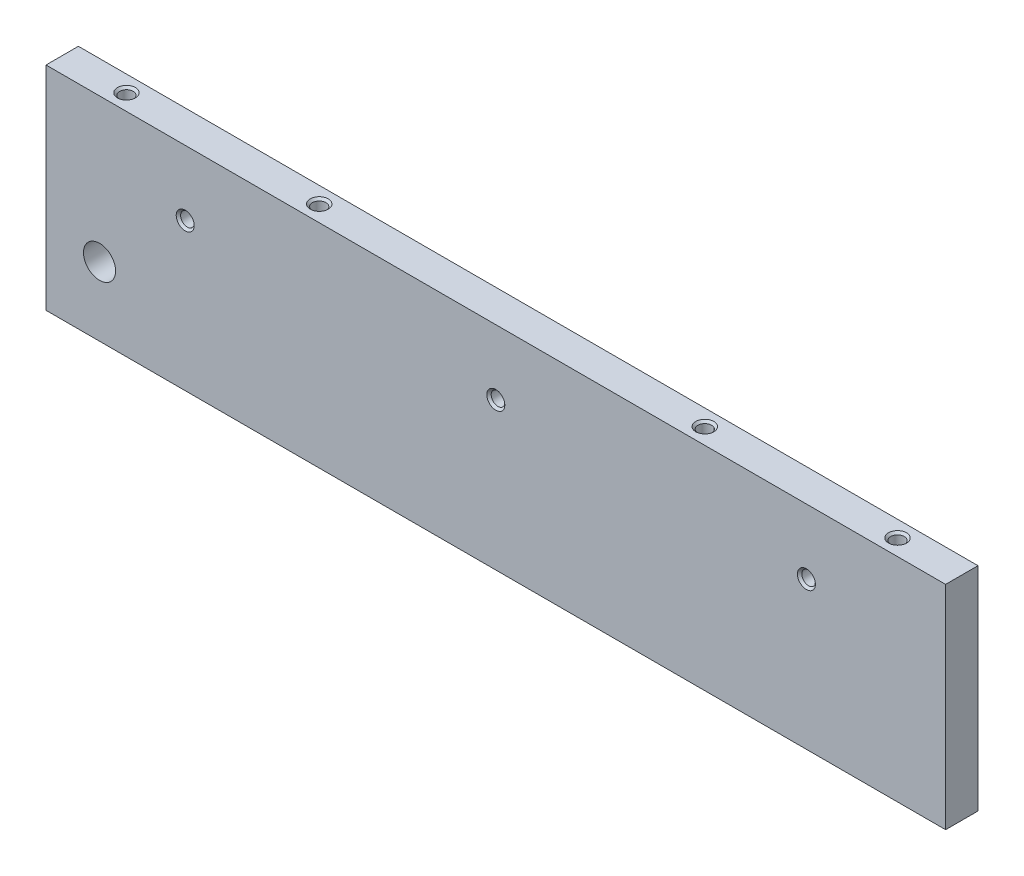
from build123d import *

# Parameters (mm, degrees)
SKETCH1_W                        = 266.7
SKETCH1_H                        = 62.992
BOSS_EXTRUDE1_DEPTH              = 9.6012
F_10_32_TAPPED_HOLE1_AT_2_COUNT  = 2
F_10_32_TAPPED_HOLE1_AT_2_PITCH  = 92.075
F_10_32_TAPPED_HOLE1_AT_3_COUNT  = 2
F_10_32_TAPPED_HOLE1_AT_3_PITCH  = 184.15
F_3_8_0_3750_DOWEL_HOLE1_D       = 9.525
F_10_32_TAPPED_HOLE2_D           = 4.0386
F_10_32_TAPPED_HOLE2_DEPTH       = 19.05
F_10_32_TAPPED_HOLE2_CSINK_D     = 5.334
F_10_32_TAPPED_HOLE2_CSINK_ANGLE = 90
F_10_32_TAPPED_HOLE2_TIP         = 1.213317848


with BuildPart() as part:
    # Sketch1 → Boss-Extrude1 (new body)
    with BuildSketch(Plane.XY):
        with Locations((0, -31.496)):
            Rectangle(SKETCH1_W, SKETCH1_H)
    extrude(amount=BOSS_EXTRUDE1_DEPTH)

    # Sketch2 → #10-32 Tapped Hole1 (revolve, cut)
    with BuildSketch(Plane(origin=(92.075, -19.304, 9.6012), x_dir=(0, -1, 0), z_dir=(1, 0, 0))):
        Polygon((0, 0), (0, 9.6012), (2.667, 9.6012), (2.0193, 8.9535), (2.0193, 0.6477), (2.667, 0), align=None)
    f_10_32_tapped_hole1 = revolve(axis=Axis((92.075, -19.304, 15.9512), (0, 0, -1)), mode=Mode.SUBTRACT)

    # #10-32 Tapped Hole1 at 2: #10-32 Tapped Hole1 ×2
    with Locations(*[(-i * F_10_32_TAPPED_HOLE1_AT_2_PITCH, 0, 0) for i in range(1, F_10_32_TAPPED_HOLE1_AT_2_COUNT)]):
        add(f_10_32_tapped_hole1, mode=Mode.SUBTRACT)

    # #10-32 Tapped Hole1 at 3: #10-32 Tapped Hole1 ×2
    with Locations(*[(-i * F_10_32_TAPPED_HOLE1_AT_3_PITCH, 0, 0) for i in range(1, F_10_32_TAPPED_HOLE1_AT_3_COUNT)]):
        add(f_10_32_tapped_hole1, mode=Mode.SUBTRACT)

    # 3/8 (0.3750) Dowel Hole1 (through all)
    with Locations(Plane.XY.offset(9.6012)):
        with Locations((-117.475, -42.5958)):
            Hole(F_3_8_0_3750_DOWEL_HOLE1_D / 2)

    # #10-32 Tapped Hole2
    with Locations(Plane(origin=(0, 0, 0), x_dir=(1, 0, 0), z_dir=(0, 1, 0))):
        with Locations((114.3, -4.8006), (57.15, -4.8006), (-57.15, -4.8006), (-114.3, -4.8006)):
            CounterSinkHole(F_10_32_TAPPED_HOLE2_D / 2, F_10_32_TAPPED_HOLE2_CSINK_D / 2, depth=F_10_32_TAPPED_HOLE2_DEPTH, counter_sink_angle=F_10_32_TAPPED_HOLE2_CSINK_ANGLE)
            with Locations((0, 0, -(F_10_32_TAPPED_HOLE2_DEPTH + F_10_32_TAPPED_HOLE2_TIP / 2))):  # 118° drill point
                Cone(0, F_10_32_TAPPED_HOLE2_D / 2, F_10_32_TAPPED_HOLE2_TIP, mode=Mode.SUBTRACT)


solid = part.part
